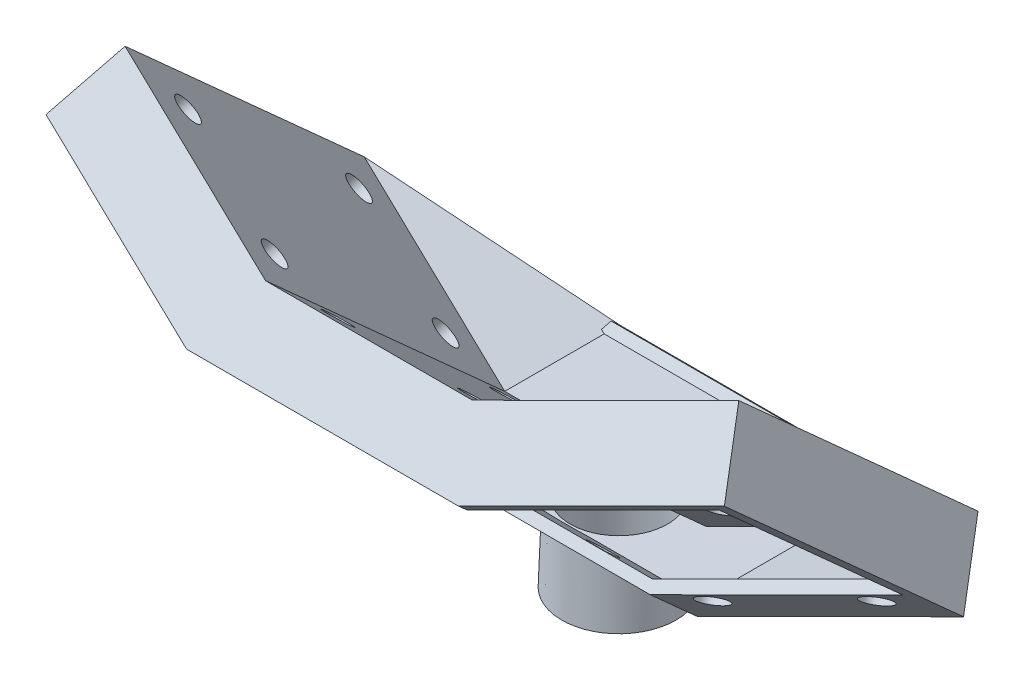
from build123d import *

# Parameters (mm, degrees)
BOSS_EXTRUDE1_DEPTH           = 28
SHELL2_T                      = -1
BOSS_EXTRUDE2_DEPTH           = 4.5
CUT_EXTRUDE1_DEPTH            = 4.5
SKETCH8_R                     = 1.2
CUT_EXTRUDE2_DEPTH            = 24.5
SKETCH9_R                     = 1.2
CUT_EXTRUDE3_DEPTH            = 24.5
SKETCH10_R                    = 1.2
CUT_EXTRUDE4_DEPTH            = 24.5
BOSS_EXTRUDE3_DEPTH           = 10
BOSS_EXTRUDE4_DEPTH           = 19.253744603
CUT_EXTRUDE5_DEPTH            = 10
CUT_EXTRUDE6_DEPTH            = 10
CUT_EXTRUDE7_DEPTH            = 10
BOSS_EXTRUDE5_DEPTH           = 19.253744603
CUT_EXTRUDE8_DEPTH            = 10
BOSS_EXTRUDE6_DEPTH           = 1
SKETCH23_R                    = 4.75
CUT_EXTRUDE9_DEPTH            = 1
SKETCH24_R                    = 4.755
BOSS_EXTRUDE7_DEPTH           = 6.2
BOSS_EXTRUDE7_TAPER           = -2
BOSS_EXTRUDE7_OTHER_WAY_DEPTH = 0.674501
SKETCH28_R                    = 4.245
CUT_EXTRUDE10_DEPTH           = 76
CUT_EXTRUDE10_DRAFT           = 2


with BuildPart() as part:
    # Sketch3 → Boss-Extrude1 (new body)
    with BuildSketch(Plane(origin=(0, 0, 0), x_dir=(1, 0, 0), z_dir=(0, 0.6691306063588569, 0.7431448254773955))):
        Polygon((-9, 0), (9, 0), (26.698804633, 8.185494155), (29.511256471, 2.104366409), (11.812451838, -6.081127746), (-11.812451838, -6.081127746), (-29.511256471, 2.104366409), (-26.698804633, 8.185494155), align=None)
    extrude(amount=BOSS_EXTRUDE1_DEPTH)

    # Shell2
    shell2_openings = [part.faces().sort_by_distance(p)[0] for p in [
        (20.661854154, 7.890173684, 11.734513919),
        (0, 4.848669872, 14.473096253),
        (-20.661854154, 7.890173684, 11.734513919),
    ]]
    offset(amount=SHELL2_T, openings=shell2_openings, kind=Kind.INTERSECTION)

    # Sketch5 → Boss-Extrude2 (add)
    with BuildSketch(Plane(origin=(0, 0.6691306063588575, 0.7431448254773962), x_dir=(1, 0, 0), z_dir=(0, 0.669130606358857, 0.7431448254773954))):
        Polygon((-28.603625464, 1.684597478), (-28.183856533, 2.592228485), (-11.392682907, -5.173496739), (11.392682907, -5.173496739), (28.183856533, 2.592228485), (28.603625464, 1.684597478), (11.812451838, -6.081127746), (-11.812451838, -6.081127746), align=None)
    extrude(amount=BOSS_EXTRUDE2_DEPTH)

    # Sketch6 → Cut-Extrude1 (cut)
    with BuildSketch(Plane(origin=(0, 0.6691306063588575, 0.7431448254773962), x_dir=(1, 0, 0), z_dir=(0, 0.669130606358857, 0.7431448254773954))):
        Polygon((9.220047236, -1), (26.210942557, 6.858094217), (28.183856533, 2.592228485), (11.392682907, -5.173496739), (-11.392682907, -5.173496739), (-28.183856533, 2.592228485), (-26.210942557, 6.858094217), (-9.220047236, -1), align=None)
    extrude(amount=-CUT_EXTRUDE1_DEPTH, mode=Mode.SUBTRACT)

    # Sketch8 → Cut-Extrude2 (cut)
    with BuildSketch(Plane(origin=(0, 0, 0), x_dir=(1, 0, 0), z_dir=(0, 0.7431448254773954, -0.669130606358857))):
        with Locations(Location((5.93, -3.91, 0), (0, 0, 270))):
            Circle(SKETCH8_R)
        with Locations(Location((-5.93, -3.91, 0), (0, 0, 270))):
            Circle(SKETCH8_R)
        with Locations(Location((5.93, -23.63, 0), (0, 0, 270))):
            Circle(SKETCH8_R)
        with Locations(Location((-5.93, -23.63, 0), (0, 0, 270))):
            Circle(SKETCH8_R)
    extrude(amount=-CUT_EXTRUDE2_DEPTH, mode=Mode.SUBTRACT)

    # Sketch9 → Cut-Extrude3 (cut)
    with BuildSketch(Plane(origin=(1.585853599, -2.548212155, 2.29442053), x_dir=(0.907631006833055, 0.3119491089708923, -0.2808802393324979), z_dir=(-0.4197689310027779, 0.6745012861708234, -0.6073236859523018))):
        with Locations(Location((23.758679061, -3.91, 0), (0, 0, 270))):
            Circle(SKETCH9_R)
        with Locations(Location((11.738679061, -3.91, 0), (0, 0, 270))):
            Circle(SKETCH9_R)
        with Locations(Location((23.758679061, -23.97, 0), (0, 0, 270))):
            Circle(SKETCH9_R)
        with Locations(Location((11.738679061, -23.97, 0), (0, 0, 270))):
            Circle(SKETCH9_R)
    extrude(amount=-CUT_EXTRUDE3_DEPTH, mode=Mode.SUBTRACT)

    # Sketch10 → Cut-Extrude4 (cut)
    with BuildSketch(Plane(origin=(-1.585853599, -2.548212155, 2.29442053), x_dir=(0.907631006833055, -0.3119491089708923, 0.2808802393324979), z_dir=(0.4197689310027779, 0.6745012861708234, -0.6073236859523018))):
        with Locations(Location((-11.738679061, -3.91, 0), (0, 0, 270))):
            Circle(SKETCH10_R)
        with Locations(Location((-23.758679061, -3.91, 0), (0, 0, 270))):
            Circle(SKETCH10_R)
        with Locations(Location((-11.738679061, -23.93, 0), (0, 0, 270))):
            Circle(SKETCH10_R)
        with Locations(Location((-23.758679061, -23.93, 0), (0, 0, 270))):
            Circle(SKETCH10_R)
    extrude(amount=-CUT_EXTRUDE4_DEPTH, mode=Mode.SUBTRACT)

    # Sketch11 → Boss-Extrude3 (add, along a direction that is not the sketch's normal)
    with BuildSketch(Plane(origin=(0, 0, 0), x_dir=(-1, 0, 0), z_dir=(0, -0.669130606358857, -0.7431448254773954))):
        Polygon((-11.812451838, -6.081127746), (-11.392682907, -5.173496739), (11.392682907, -5.173496739), (11.812451838, -6.081127746), align=None)
        Polygon((-9.220047236, -1), (-9, 0), (9, 0), (9.220047236, -1), align=None)
    extrude(amount=BOSS_EXTRUDE3_DEPTH, dir=(0, 0, -1))

    # Sketch12 → Boss-Extrude4 (add, along a direction that is not the sketch's normal)
    with BuildSketch(Plane(origin=(0, 0, 0), x_dir=(-1, 0, 0), z_dir=(0, -0.669130606358857, -0.7431448254773954))):
        Polygon((-11.812451838, -6.081127746), (-11.392682907, -5.173496739), (-28.183856533, 2.592228485), (-26.210942557, 6.858094217), (-9.220047236, -1), (-9, 0), (-26.698804633, 8.185494155), (-29.511256471, 2.104366409), align=None)
    extrude(amount=BOSS_EXTRUDE4_DEPTH, dir=(-0.9192395760563791, -0.3159389272983625, -0.2349067815735609))

    # Sketch14 → Cut-Extrude5 (cut, along a direction that is not the sketch's normal)
    with BuildSketch(Plane(origin=(0, -4.972609477, -5.522642316), x_dir=(-1, 0, 0), z_dir=(0, -0.6691306063588573, -0.743144825477395))):
        Polygon((4.148710376, 0.610178318), (1.766447359, 0.610178318), (8.478757397, -2.494188091), (8.698804633, -1.494188091), align=None)
    extrude(amount=-CUT_EXTRUDE5_DEPTH, dir=(0, 0, -1), mode=Mode.SUBTRACT)

    # Sketch15 → Cut-Extrude6 (cut, along a direction that is not the sketch's normal)
    with BuildSketch(Plane(origin=(0, -4.972609477, -5.522642316), x_dir=(-1, 0, 0), z_dir=(0, -0.6691306063588573, -0.743144825477395))):
        Polygon((-11.812451838, 0.610178318), (-9.430188821, 0.610178318), (6.306121727, -6.66768483), (5.886352796, -7.575315837), align=None)
    extrude(amount=-CUT_EXTRUDE6_DEPTH, dir=(0, 0, -1), mode=Mode.SUBTRACT)

    # Sketch16 → Cut-Extrude7 (cut, along a direction that is not the sketch's normal)
    with BuildSketch(Plane(origin=(0, -4.972609477, -5.522642316), x_dir=(-1, 0, 0), z_dir=(0, -0.6691306063588573, -0.743144825477395))):
        Polygon((-0.196046727, 1.517809325), (2.18621629, 1.517809325), (-6.837784219, 5.691306064), (-8.512137924, 5.363906126), align=None)
    extrude(amount=-CUT_EXTRUDE7_DEPTH, dir=(0, 0, -1), mode=Mode.SUBTRACT)

    # Sketch18 → Boss-Extrude5 (add, along a direction that is not the sketch's normal)
    with BuildSketch(Plane(origin=(0, 0, 0), x_dir=(-1, 0, 0), z_dir=(0, -0.669130606358857, -0.7431448254773954))):
        Polygon((9, 0), (9.220047236, -1), (26.210942557, 6.858094217), (28.183856533, 2.592228485), (11.392682907, -5.173496739), (11.812451838, -6.081127746), (29.511256471, 2.104366409), (26.698804633, 8.185494155), align=None)
    extrude(amount=BOSS_EXTRUDE5_DEPTH, dir=(0.9192395760563791, -0.3159389272983624, -0.2349067815735607))

    # Sketch19 → Cut-Extrude8 (cut, along a direction that is not the sketch's normal)
    with BuildSketch(Plane(origin=(0, -4.972609477, -5.522642316), x_dir=(-1, 0, 0), z_dir=(0, -0.6691306063588573, -0.743144825477395))):
        Polygon((6.837784219, 5.691306064), (8.512137924, 5.363906126), (0.196046727, 1.517809325), (-2.18621629, 1.517809325), align=None)
        Polygon((-4.148710376, 0.610178318), (-1.766447359, 0.610178318), (-8.478757397, -2.494188091), (-8.698804633, -1.494188091), align=None)
        Polygon((9.430188821, 0.610178318), (11.812451838, 0.610178318), (-5.886352796, -7.575315837), (-6.306121727, -6.66768483), align=None)
    extrude(amount=-CUT_EXTRUDE8_DEPTH, dir=(0, 0, -1), mode=Mode.SUBTRACT)

    # Sketch20 → Boss-Extrude6 (add)
    with BuildSketch(Plane(origin=(0, -4.972609477, -5.522642316), x_dir=(-1, 0, 0), z_dir=(0, -0.6691306063588573, -0.743144825477395))):
        Polygon((-11.812451838, 0.610178318), (-9, 6.691306064), (9, 6.691306064), (11.812451838, 0.610178318), align=None)
    extrude(amount=-BOSS_EXTRUDE6_DEPTH)

    # Sketch23 → Cut-Extrude9 (cut)
    with BuildSketch(Plane.XZ.offset(4.519158617)):
        with Locations((0.002451838, -0.930931304)):
            Circle(SKETCH23_R)
    extrude(amount=-CUT_EXTRUDE9_DEPTH, mode=Mode.SUBTRACT)

    # Sketch24 → Boss-Extrude7 (add)
    with BuildSketch(Plane.XZ.offset(4.519158617)):
        with Locations((0.002451838, -0.930931304)):
            Circle(SKETCH24_R)
    extrude(amount=BOSS_EXTRUDE7_DEPTH, taper=BOSS_EXTRUDE7_TAPER)

    # Sketch24 → Boss-Extrude7 other way (add)
    with BuildSketch(Plane.XZ.offset(4.519158617)):
        with Locations((0.002451838, -0.930931304)):
            Circle(SKETCH24_R)
    extrude(amount=-BOSS_EXTRUDE7_OTHER_WAY_DEPTH)


with BuildPart() as cut_extrude10_tool:
    # Sketch28 → Cut-Extrude10 (with draft: the straight prism first)
    with BuildSketch(Plane(origin=(0, -3.844657331, 0), x_dir=(1, 0, 0), z_dir=(0, 1, 0))):
        with Locations((0.002451838, 0.930931304)):
            Circle(SKETCH28_R)
    extrude(amount=-CUT_EXTRUDE10_DEPTH)
    # Cut-Extrude10: the draft: its side faces are tilted about the plane it starts from
    cut_extrude10_sides = [cut_extrude10_tool.faces().sort_by_distance(p)[0] for p in [
        (-4.242548162, -41.844657331, -0.930931304),
    ]]
    draft(cut_extrude10_sides, Plane(origin=(0, -3.844657331, 0), x_dir=(1, 0, 0), z_dir=(0, 1, 0)), CUT_EXTRUDE10_DRAFT)


with BuildPart() as part_1:
    add(part.part)

    # Cut-Extrude10: cut by cut_extrude10_tool
    add(cut_extrude10_tool.part, mode=Mode.SUBTRACT)


solid = part_1.part
